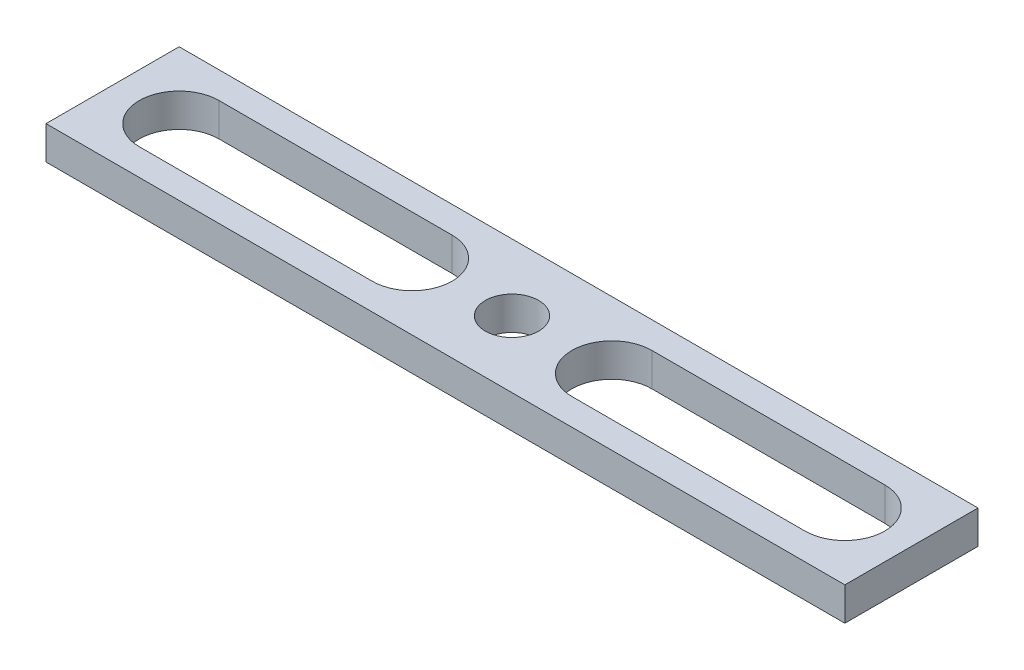
from build123d import *

# Parameters (mm, degrees)
SKETCH1_W           = 76.2
SKETCH1_H           = 12.7
BOSS_EXTRUDE1_DEPTH = 3.175
SKETCH2_R           = 2.54
CUT_EXTRUDE1_DEPTH  = 39.75581408
CUT_EXTRUDE2_DEPTH  = 39.75581408


with BuildPart() as part:
    # Sketch1 → Boss-Extrude1 (new body)
    with BuildSketch(Plane(origin=(0, 0, 0), x_dir=(1, 0, 0), z_dir=(0, 1, 0))):
        Rectangle(SKETCH1_W, SKETCH1_H)
    extrude(amount=BOSS_EXTRUDE1_DEPTH)

    # Sketch2 → Cut-Extrude1 (cut, through all)
    with BuildSketch(Plane(origin=(0, 3.175, 0), x_dir=(1, 0, 0), z_dir=(0, 1, 0))):
        with Locations(Location((0, 0, 0), (0, 0, 270))):
            Circle(SKETCH2_R)
    extrude(amount=-CUT_EXTRUDE1_DEPTH, mode=Mode.SUBTRACT)

    # Sketch4 → Cut-Extrude2 (cut, through all)
    with BuildSketch(Plane(origin=(0, 3.175, 0), x_dir=(1, 0, 0), z_dir=(0, 1, 0))):
        with BuildLine():
            Line((-31.75, 3.81), (-9.525, 3.81))
            ThreePointArc((-9.525, 3.81), (-5.715, 0), (-9.525, -3.81))
            Line((-9.525, -3.81), (-31.75, -3.81))
            ThreePointArc((-31.75, -3.81), (-35.56, 0), (-31.75, 3.81))
        make_face()
        with BuildLine():
            Line((9.525, 3.81), (31.75, 3.81))
            ThreePointArc((31.75, 3.81), (35.56, 0), (31.75, -3.81))
            Line((31.75, -3.81), (9.525, -3.81))
            ThreePointArc((9.525, -3.81), (5.715, 0), (9.525, 3.81))
        make_face()
    extrude(amount=-CUT_EXTRUDE2_DEPTH, mode=Mode.SUBTRACT)


solid = part.part
